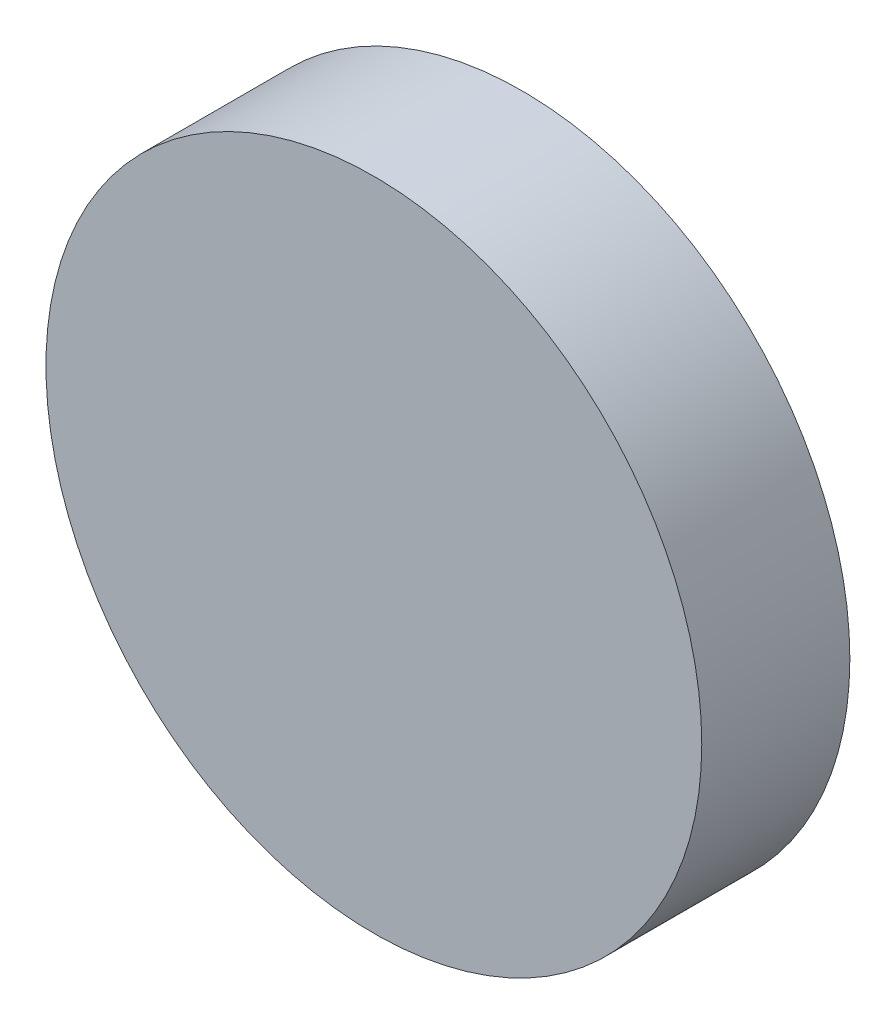
from build123d import *

# Parameters (mm, degrees)
ESQUISSE1_R             = 31
BOSS_EXTRU_1_DEPTH      = 14
ESQUISSE2_R             = 22.5
ESQUISSE2_R_2           = 12.5
ENL_V_MAT_EXTRU_1_DEPTH = 3


with BuildPart() as part:
    # Esquisse1 → Boss.-Extru.1 (new body)
    with BuildSketch(Plane.XY):
        Circle(ESQUISSE1_R)
    extrude(amount=BOSS_EXTRU_1_DEPTH)

    # Esquisse2 → Enlèv. mat.-Extru.1 (cut)
    with BuildSketch(Plane(origin=(0, 0, 0), x_dir=(-1, 0, 0), z_dir=(0, 0, -1))):
        Circle(ESQUISSE2_R)
        Circle(ESQUISSE2_R_2, mode=Mode.SUBTRACT)
    extrude(amount=-ENL_V_MAT_EXTRU_1_DEPTH, mode=Mode.SUBTRACT)


solid = part.part
